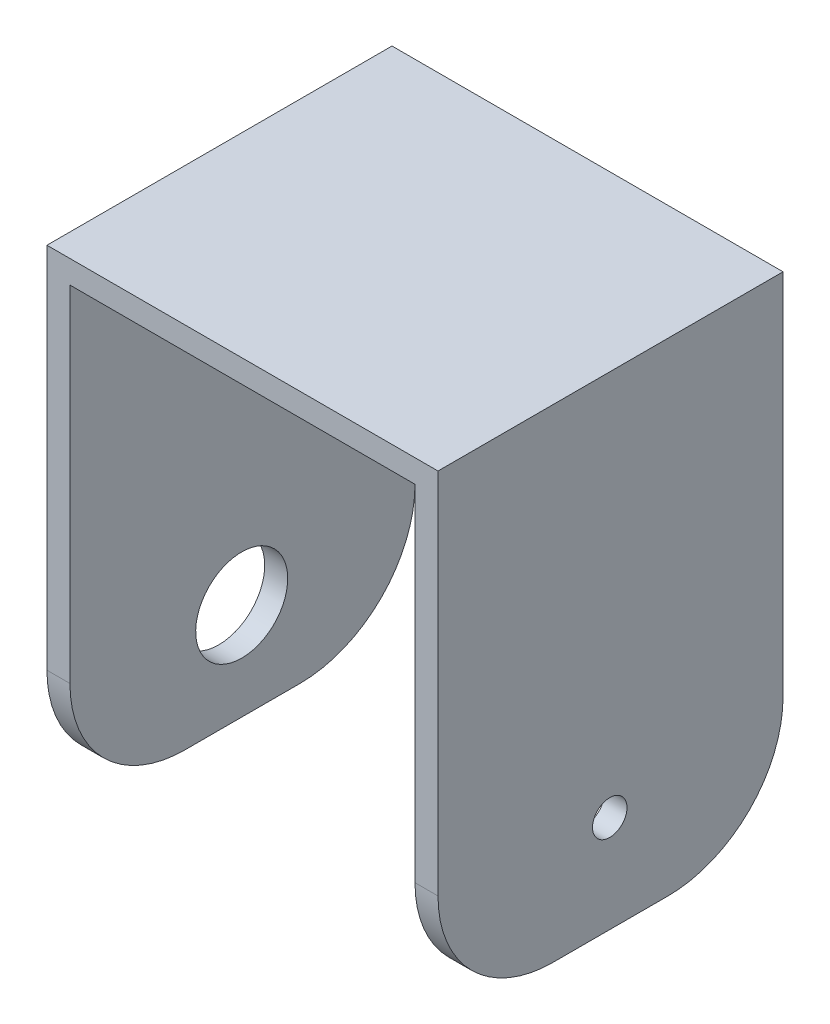
from build123d import *

# Parameters (mm, degrees)
BOSS_EXTRUDE1_DEPTH = 30
FILLET1_R           = 10
SKETCH4_R           = 4
CUT_EXTRUDE1_DEPTH  = 3
SKETCH5_R           = 1.5
CUT_EXTRUDE2_DEPTH  = 3


with BuildPart() as part:
    # Sketch1 → Boss-Extrude1 (new body)
    with BuildSketch(Plane.XY):
        Polygon((0, 0), (0, 40), (-30, 40), (-30, 0), (-32, 0), (-32, 42), (2, 42), (2, 0), align=None)
    extrude(amount=BOSS_EXTRUDE1_DEPTH)

    # Fillet1
    fillet1_edges = [part.edges().sort_by_distance(p)[0] for p in [
        (1, 0, 0),
        (-31, 0, 30),
        (1, 0, 30),
        (-31, 0, 0),
    ]]
    fillet(fillet1_edges, radius=FILLET1_R)

    # Sketch4 → Cut-Extrude1 (cut)
    with BuildSketch(Plane.ZY.offset(32)):
        with Locations(Location((15.066442129, 8.440123405, 0), (0, 0, 270))):
            Circle(SKETCH4_R)
    extrude(amount=-CUT_EXTRUDE1_DEPTH, mode=Mode.SUBTRACT)

    # Sketch5 → Cut-Extrude2 (cut)
    with BuildSketch(Plane(origin=(2, 0, 0), x_dir=(0, 0, -1), z_dir=(1, 0, 0))):
        with Locations((-15.066442129, 8.440123405)):
            Circle(SKETCH5_R)
    extrude(amount=-CUT_EXTRUDE2_DEPTH, mode=Mode.SUBTRACT)


solid = part.part
